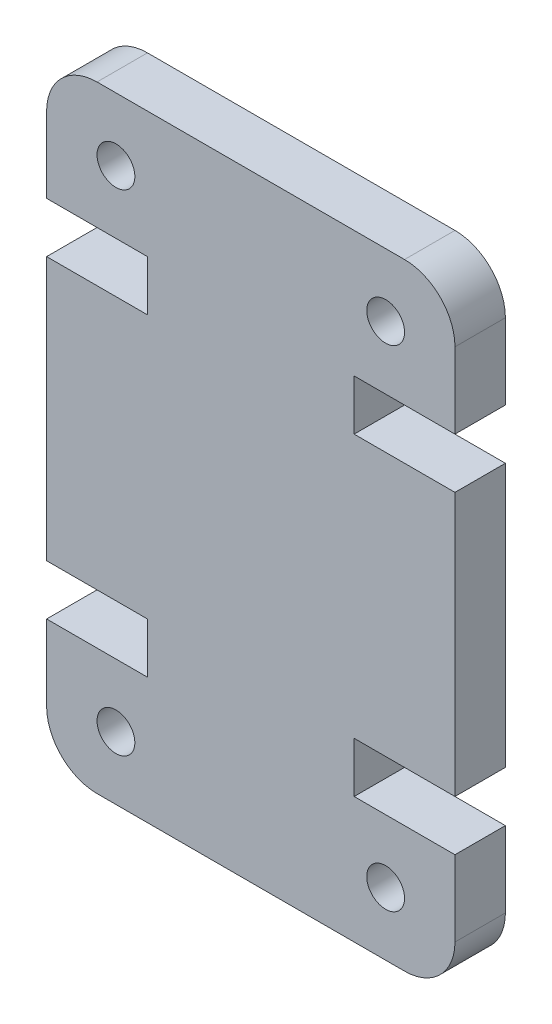
from build123d import *

# Parameters (mm, degrees)
SKETCH1_R           = 0.75
BOSS_EXTRUDE1_DEPTH = 2


with BuildPart() as part:
    # Sketch1 → Boss-Extrude1 (new body)
    with BuildSketch(Plane.XY):
        with BuildLine():
            Line((0, 17.45), (0, 7))
            Line((0, 7), (4, 7))
            Line((4, 7), (4, 5))
            Line((4, 5), (0, 5))
            Line((0, 5), (0, 2))
            ThreePointArc((0, 2), (0.585786438, 0.585786438), (2, 0))
            Line((2, 0), (14.2, 0))
            ThreePointArc((14.2, 0), (15.614213562, 0.585786438), (16.2, 2))
            Line((16.2, 2), (16.2, 5))
            Line((16.2, 5), (12.2, 5))
            Line((12.2, 5), (12.2, 7))
            Line((12.2, 7), (16.2, 7))
            Line((16.2, 7), (16.2, 17.45))
            Line((16.2, 17.45), (12.2, 17.45))
            Line((12.2, 17.45), (12.2, 19.45))
            Line((12.2, 19.45), (16.2, 19.45))
            Line((16.2, 19.45), (16.2, 22.45))
            ThreePointArc((16.2, 22.45), (15.614213562, 23.864213562), (14.2, 24.45))
            Line((14.2, 24.45), (2, 24.45))
            ThreePointArc((2, 24.45), (0.585786438, 23.864213562), (0, 22.45))
            Line((0, 22.45), (0, 19.45))
            Line((0, 19.45), (4, 19.45))
            Line((4, 19.45), (4, 17.45))
            Line((4, 17.45), (0, 17.45))
        make_face()
        with Locations(Location((13.45, 2.5, 0), (0, 0, 180))):
            Circle(SKETCH1_R, mode=Mode.SUBTRACT)
        with Locations(Location((2.75, 21.95, 0), (0, 0, 180))):
            Circle(SKETCH1_R, mode=Mode.SUBTRACT)
        with Locations((2.75, 2.5)):
            Circle(SKETCH1_R, mode=Mode.SUBTRACT)
        with Locations((13.45, 21.95)):
            Circle(SKETCH1_R, mode=Mode.SUBTRACT)
    extrude(amount=BOSS_EXTRUDE1_DEPTH)


solid = part.part
